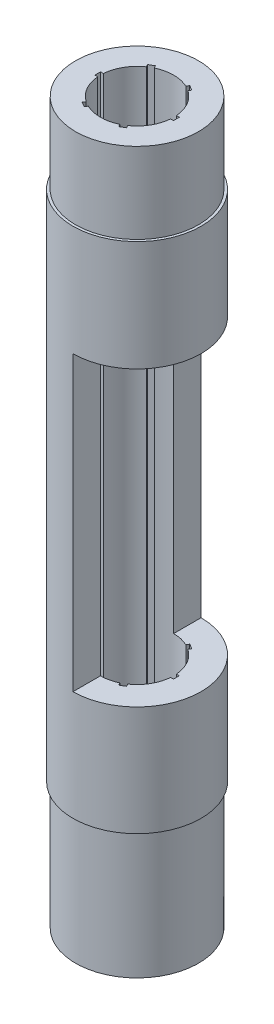
from build123d import *

# Parameters (mm, degrees)
SKETCH1_R               = 11.1125
SKETCH1_R_2             = 6.35
BOSS_EXTRUDE1_DEPTH     = 125
CUT_EXTRUDE1_START      = -14
SKETCH2_R               = 11.1125
SKETCH2_R_2             = 10.668
CUT_EXTRUDE1_DEPTH      = 14
SKETCH3_R               = 11.1125
SKETCH3_R_2             = 10.668
CUT_EXTRUDE2_DEPTH      = 22
CUT_EXTRUDE3_DEPTH      = 126.984028006
CUT_EXTRUDE3_DEPTH_BACK = 126.984028006
SKETCH4_W               = 11.1125
SKETCH4_H               = 50.8
SKETCH6_W               = 0.5
SKETCH6_H               = 1
CUT_EXTRUDE4_DEPTH      = 126.984028006
CIRPATTERN1_COUNT       = 6


with BuildPart() as part:
    # Sketch1 → Boss-Extrude1 (new body)
    with BuildSketch(Plane(origin=(0, 0, 0), x_dir=(1, 0, 0), z_dir=(0, 1, 0))):
        with Locations(Location((0, 0, 0), (0, 0, 270))):
            Circle(SKETCH1_R)
        with Locations(Location((0, 0, 0), (0, 0, 270))):
            Circle(SKETCH1_R_2, mode=Mode.SUBTRACT)
    extrude(amount=BOSS_EXTRUDE1_DEPTH)

    # Sketch2 → Cut-Extrude1 (cut)
    with BuildSketch(Plane(origin=(0, 125, 0), x_dir=(1, 0, 0), z_dir=(0, 1, 0)).offset(CUT_EXTRUDE1_START)):
        with Locations(Location((0, 0, 0), (0, 0, 270))):
            Circle(SKETCH2_R)
        with Locations(Location((0, 0, 0), (0, 0, 270))):
            Circle(SKETCH2_R_2, mode=Mode.SUBTRACT)
    extrude(amount=CUT_EXTRUDE1_DEPTH, mode=Mode.SUBTRACT)

    # Sketch3 → Cut-Extrude2 (cut)
    with BuildSketch(Plane.XZ):
        with Locations(Location((0, 0, 0), (0, 0, 270))):
            Circle(SKETCH3_R)
        with Locations(Location((0, 0, 0), (0, 0, 90))):
            Circle(SKETCH3_R_2, mode=Mode.SUBTRACT)
    extrude(amount=-CUT_EXTRUDE2_DEPTH, mode=Mode.SUBTRACT)

    # Sketch4 → Cut-Extrude3 (cut, two sides: drawn at the far end of the back side and taken through both)
    with BuildSketch(Plane.XY.offset(-CUT_EXTRUDE3_DEPTH_BACK)):
        with Locations((5.55625, 66.45)):
            Rectangle(SKETCH4_W, SKETCH4_H)
    extrude(amount=CUT_EXTRUDE3_DEPTH + CUT_EXTRUDE3_DEPTH_BACK, mode=Mode.SUBTRACT)

    # Sketch6 → Cut-Extrude4 (cut, through all)
    with BuildSketch(Plane.XZ):
        with Locations((-6.580284354, 0)):
            Rectangle(SKETCH6_W, SKETCH6_H)
    cut_extrude4 = extrude(amount=-CUT_EXTRUDE4_DEPTH, mode=Mode.SUBTRACT)

    # CirPattern1: Cut-Extrude4 ×6 about axis
    cirpattern1_axis = Axis((0, 0, 0), (0, 1, 0))
    for i in range(1, CIRPATTERN1_COUNT):
        add(cut_extrude4.rotate(cirpattern1_axis, i * 360 / CIRPATTERN1_COUNT), mode=Mode.SUBTRACT)


solid = part.part
